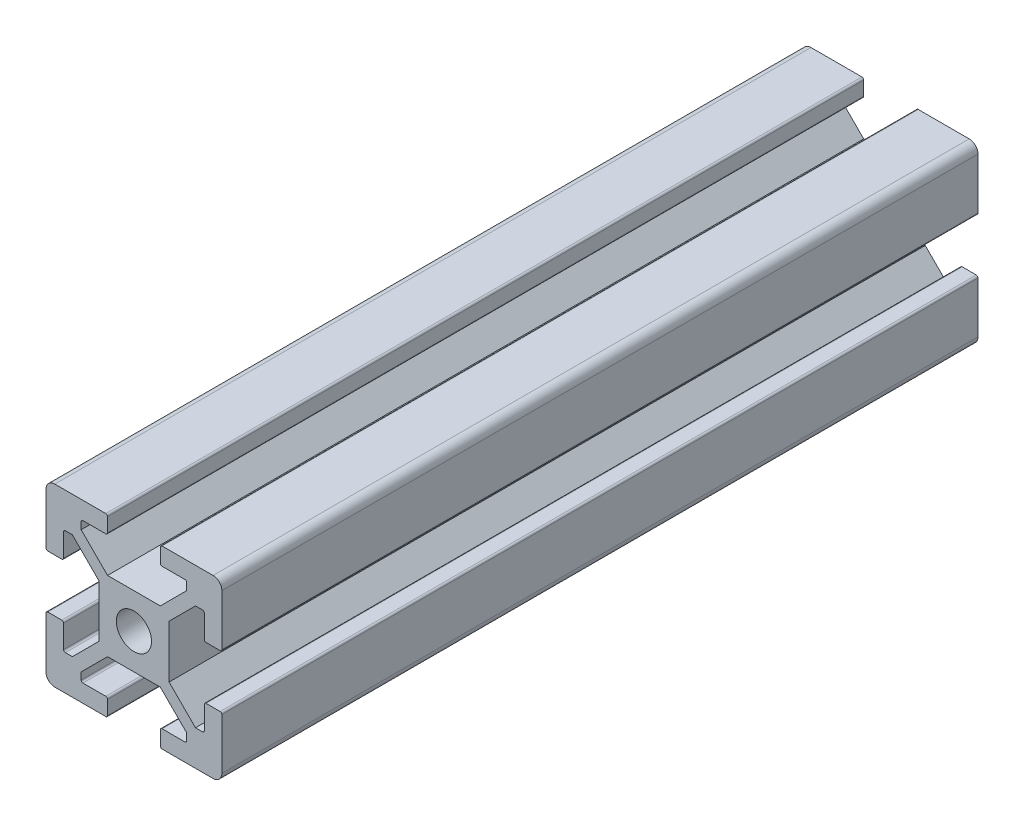
from build123d import *

# Parameters (mm, degrees)
SKETCH1_R           = 2
BOSS_EXTRUDE1_DEPTH = 86


with BuildPart() as part:
    # Sketch1 → Boss-Extrude1 (new body)
    with BuildSketch(Plane.XY):
        with BuildLine():
            Line((-3.2, 8), (-5.800532354, 8))
            ThreePointArc((-5.800532354, 8), (-5.941765118, 7.941609697), (-6.000531643, 7.800533062))
            Line((-6.000531643, 7.800533062), (-6.002658236, 7.002658236))
            Line((-6.002658236, 7.002658236), (-3, 4))
            Line((-3, 4), (3, 4))
            Line((3, 4), (6.002658236, 7.002658236))
            Line((6.002658236, 7.002658236), (6.000531643, 7.800533062))
            ThreePointArc((6.000531643, 7.800533062), (5.941765118, 7.941609697), (5.800532354, 8))
            Line((5.800532354, 8), (3.2, 8))
            ThreePointArc((3.2, 8), (3.058578644, 8.058578644), (3, 8.2))
            Line((3, 8.2), (3, 9.8))
            ThreePointArc((3, 9.8), (3.058578644, 9.941421356), (3.2, 10))
            Line((3.2, 10), (9, 10))
            ThreePointArc((9, 10), (9.707106781, 9.707106781), (10, 9))
            Line((10, 9), (10, 3.2))
            ThreePointArc((10, 3.2), (9.941421356, 3.058578644), (9.8, 3))
            Line((9.8, 3), (8.2, 3))
            ThreePointArc((8.2, 3), (8.058578644, 3.058578644), (8, 3.2))
            Line((8, 3.2), (8, 5.800532354))
            ThreePointArc((8, 5.800532354), (7.941609697, 5.941765118), (7.800533062, 6.000531643))
            Line((7.800533062, 6.000531643), (7.002658236, 6.002658236))
            Line((7.002658236, 6.002658236), (4, 3))
            Line((4, 3), (4, -3))
            Line((4, -3), (7.002658236, -6.002658236))
            Line((7.002658236, -6.002658236), (7.800533062, -6.000531643))
            ThreePointArc((7.800533062, -6.000531643), (7.941609697, -5.941765118), (8, -5.800532354))
            Line((8, -5.800532354), (8, -3.2))
            ThreePointArc((8, -3.2), (8.058578644, -3.058578644), (8.2, -3))
            Line((8.2, -3), (9.8, -3))
            ThreePointArc((9.8, -3), (9.941421356, -3.058578644), (10, -3.2))
            Line((10, -3.2), (10, -9))
            ThreePointArc((10, -9), (9.707106781, -9.707106781), (9, -10))
            Line((9, -10), (3.2, -10))
            ThreePointArc((3.2, -10), (3.058578644, -9.941421356), (3, -9.8))
            Line((3, -9.8), (3, -8.2))
            ThreePointArc((3, -8.2), (3.058578644, -8.058578644), (3.2, -8))
            Line((3.2, -8), (5.800532354, -8))
            ThreePointArc((5.800532354, -8), (5.941765118, -7.941609697), (6.000531643, -7.800533062))
            Line((6.000531643, -7.800533062), (6.002658236, -7.002658236))
            Line((6.002658236, -7.002658236), (3, -4))
            Line((3, -4), (-3, -4))
            Line((-3, -4), (-6.002658236, -7.002658236))
            Line((-6.002658236, -7.002658236), (-6.000531643, -7.800533062))
            ThreePointArc((-6.000531643, -7.800533062), (-5.941765118, -7.941609697), (-5.800532354, -8))
            Line((-5.800532354, -8), (-3.2, -8))
            ThreePointArc((-3.2, -8), (-3.058578644, -8.058578644), (-3, -8.2))
            Line((-3, -8.2), (-3, -9.8))
            ThreePointArc((-3, -9.8), (-3.058578644, -9.941421356), (-3.2, -10))
            Line((-3.2, -10), (-9, -10))
            ThreePointArc((-9, -10), (-9.707106781, -9.707106781), (-10, -9))
            Line((-10, -9), (-10, -3.2))
            ThreePointArc((-10, -3.2), (-9.941421356, -3.058578644), (-9.8, -3))
            Line((-9.8, -3), (-8.2, -3))
            ThreePointArc((-8.2, -3), (-8.058578644, -3.058578644), (-8, -3.2))
            Line((-8, -3.2), (-8, -5.800532354))
            ThreePointArc((-8, -5.800532354), (-7.941609697, -5.941765118), (-7.800533062, -6.000531643))
            Line((-7.800533062, -6.000531643), (-7.002658236, -6.002658236))
            Line((-7.002658236, -6.002658236), (-4, -3))
            Line((-4, -3), (-4, 3))
            Line((-4, 3), (-7.002658236, 6.002658236))
            Line((-7.002658236, 6.002658236), (-7.800533062, 6.000531643))
            ThreePointArc((-7.800533062, 6.000531643), (-7.941609697, 5.941765118), (-8, 5.800532354))
            Line((-8, 5.800532354), (-8, 3.2))
            ThreePointArc((-8, 3.2), (-8.058578644, 3.058578644), (-8.2, 3))
            Line((-8.2, 3), (-9.8, 3))
            ThreePointArc((-9.8, 3), (-9.941421356, 3.058578644), (-10, 3.2))
            Line((-10, 3.2), (-10, 9))
            ThreePointArc((-10, 9), (-9.707106781, 9.707106781), (-9, 10))
            Line((-9, 10), (-3.2, 10))
            ThreePointArc((-3.2, 10), (-3.058578644, 9.941421356), (-3, 9.8))
            Line((-3, 9.8), (-3, 8.2))
            ThreePointArc((-3, 8.2), (-3.058578644, 8.058578644), (-3.2, 8))
        make_face()
        Circle(SKETCH1_R, mode=Mode.SUBTRACT)
    extrude(amount=BOSS_EXTRUDE1_DEPTH)


solid = part.part
